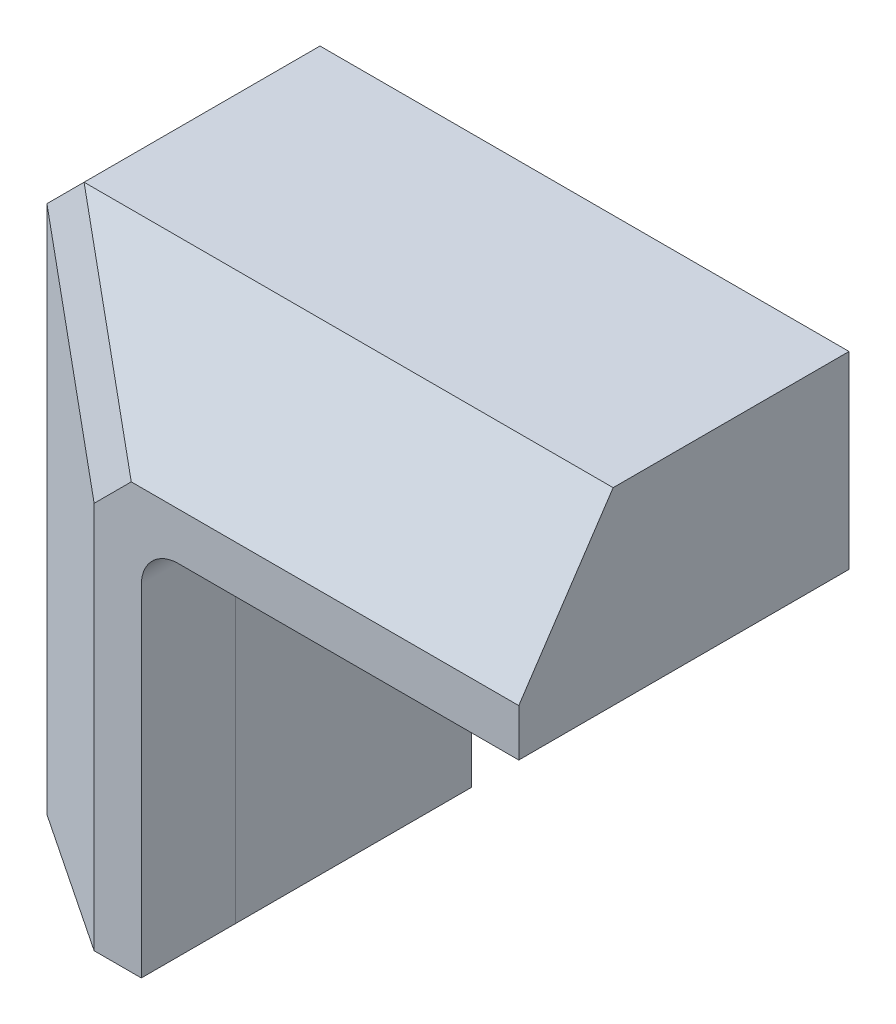
from build123d import *

# Parameters (mm, degrees)
BOSS_EXTRUDE1_DEPTH = 12.7
CUT_EXTRUDE1_DEPTH  = 2.54


with BuildPart() as part:
    # Sketch1 → Boss-Extrude1 (new body)
    with BuildSketch(Plane.XY):
        with BuildLine():
            Line((-10.16, 8.16102), (-8.16102, 10.16))
            Line((-8.16102, 10.16), (20.32, 10.16))
            Line((20.32, 10.16), (20.32, 0))
            Line((20.32, 0), (1.99898, 0))
            ThreePointArc((1.99898, 0), (0.585487687, -0.585487687), (0, -1.99898))
            Line((0, -1.99898), (0, -20.32))
            Line((0, -20.32), (-10.16, -20.32))
            Line((-10.16, -20.32), (-10.16, 0))
            Line((-10.16, 0), (-10.16, 8.16102))
        make_face()
    extrude(amount=BOSS_EXTRUDE1_DEPTH)

    # Sketch2 for Loft1 → Loft1 section 0
    with BuildSketch(Plane.XY.offset(12.7)):
        with BuildLine():
            Line((-10.16, -20.32), (0, -20.32))
            Line((0, -20.32), (0, -1.99898))
            # circular arc as an exact rational Bezier (weights 1, cos(half-angle), 1)
            Bezier((0, -1.99898), (0, 0), (1.99898, 0), weights=[1, 0.707106781, 1])
            Line((1.99898, 0), (20.32, 0))
            Line((20.32, 0), (20.32, 10.16))
            Line((20.32, 10.16), (-8.16102, 10.16))
            Line((-8.16102, 10.16), (-10.16, 8.16102))
            Line((-10.16, 8.16102), (-10.16, -20.32))
        make_face()
    # Sketch3 for Loft1 → Loft1 section 1
    with BuildSketch(Plane.XY.offset(17.78)):
        with BuildLine():
            Line((0, -20.32), (0, -1.99898))
            Bezier((0, -1.99898), (0, 0), (1.99898, 0), weights=[1, 0.707106781, 1])
            Line((1.99898, 0), (20.32, 0))
            Line((20.32, 0), (20.32, 2.54))
            Line((20.32, 2.54), (-0.54102, 2.54))
            Line((-0.54102, 2.54), (-2.54, 0.54102))
            Line((-2.54, 0.54102), (-2.54, -20.32))
            Line((-2.54, -20.32), (0, -20.32))
        make_face()
    loft()

    # Sketch4 → Cut-Extrude1 (cut)
    # profile 1 of 6: a face of its own
    with BuildSketch(Plane.XY):
        with BuildLine():
            Line((2.507435897, 5.290776242), (2.933567708, 4.900897436))
            add(Edge.make_bspline(
                [(2.933567708, 4.900897436), (2.951821368, 4.92664612), (2.986865849, 4.976080004), (3.043669297, 5.042273139), (3.100216248, 5.098740809), (3.157030576, 5.145247119), (3.214615861, 5.181509507), (3.272872143, 5.207183679), (3.331469152, 5.223504993), (3.370837296, 5.22553739), (3.390228365, 5.226538462)],
                knots=[0, 0, 0, 0, 1.299362458, 2.494594718, 3.587462134, 4.587049575, 5.512617175, 6.380583204, 7.202344345, 8, 8, 8, 8], degree=3))
            add(Edge.make_bspline(
                [(3.390228365, 5.226538462), (3.408315798, 5.225904137), (3.44323788, 5.224679422), (3.493021897, 5.212505847), (3.537220857, 5.191496044), (3.575791622, 5.16402396), (3.606345359, 5.130926467), (3.630740149, 5.096215707), (3.644476466, 5.057902879), (3.646284435, 5.031588082), (3.647179487, 5.018560697)],
                knots=[0, 0, 0, 0, 1.185010067, 2.2879431, 3.333075148, 4.379039566, 5.372662701, 6.27520591, 7.14612461, 8, 8, 8, 8], degree=3))
            add(Edge.make_bspline(
                [(3.647179487, 5.018560697), (3.646618603, 5.005345451), (3.645489061, 4.978731783), (3.634579223, 4.939726137), (3.61813498, 4.90161308), (3.602421836, 4.878411849), (3.594390024, 4.866552484)],
                knots=[0, 0, 0, 0, 0.967525499, 1.948461899, 2.951351359, 4, 4, 4, 4], degree=3))
            add(Edge.make_bspline(
                [(3.594390024, 4.866552484), (3.587088238, 4.857334324), (3.570280492, 4.836115336), (3.538231562, 4.802507766), (3.497984837, 4.761335552), (3.447991537, 4.714014485), (3.390327024, 4.658842714), (3.32231847, 4.597989063), (3.245923461, 4.529568965), (3.191623658, 4.481923686), (3.163170072, 4.456957131)],
                knots=[0, 0, 0, 0, 0.473873513, 1.090794244, 1.870441696, 2.795289791, 3.865433203, 5.087734844, 6.473946851, 8, 8, 8, 8], degree=3))
            add(Edge.make_bspline(
                [(3.163170072, 4.456957131), (3.136462289, 4.433842892), (3.085776466, 4.389976869), (3.013660605, 4.327716092), (2.950282774, 4.271701589), (2.894719702, 4.222774018), (2.847813672, 4.180420016), (2.80936749, 4.144437133), (2.778911602, 4.115525888), (2.761599213, 4.098063478), (2.754210737, 4.090610978)],
                knots=[0, 0, 0, 0, 1.543621617, 2.929473131, 4.163658386, 5.240097082, 6.164993805, 6.925417477, 7.541396219, 8, 8, 8, 8], degree=3))
            add(Edge.make_bspline(
                [(2.754210737, 4.090610978), (2.7261804, 4.060276149), (2.672296248, 4.001961956), (2.602265845, 3.911593297), (2.544628559, 3.823375058), (2.500039261, 3.735647272), (2.46636363, 3.6471442), (2.442621864, 3.55569531), (2.428402762, 3.460345018), (2.42682411, 3.395280084), (2.426025641, 3.362370793)],
                knots=[0, 0, 0, 0, 1.206664779, 2.319633467, 3.337109185, 4.282041471, 5.190008762, 6.099243693, 7.03861361, 8, 8, 8, 8], degree=3))
            add(Edge.make_bspline(
                [(2.426025641, 3.362370793), (2.426593971, 3.330304725), (2.427709055, 3.267389906), (2.441366696, 3.17532344), (2.460841691, 3.087211837), (2.49095345, 3.004013874), (2.527653483, 2.924363884), (2.573662275, 2.849502559), (2.627693293, 2.778672272), (2.689621135, 2.713139201), (2.758120683, 2.653672482), (2.831592957, 2.600733804), (2.910756408, 2.557026182), (2.994934675, 2.521036073), (3.084082699, 2.49331601), (3.178094278, 2.4728283), (3.27711321, 2.460531899), (3.344823782, 2.459246456), (3.379416066, 2.458589744)],
                knots=[0, 0, 0, 0, 1.043214005, 2.046824704, 3.02475056, 3.976699089, 4.921714032, 5.875962561, 6.831408892, 7.817874052, 8.806269674, 9.781291748, 10.760897367, 11.74438705, 12.757449933, 13.795994037, 14.874007457, 16, 16, 16, 16], degree=3))
            add(Edge.make_bspline(
                [(3.379416066, 2.458589744), (3.406570714, 2.459071485), (3.46035249, 2.46002561), (3.539618698, 2.467815242), (3.616159182, 2.480386881), (3.689887727, 2.498405794), (3.761136491, 2.521238201), (3.829908403, 2.549127112), (3.895728706, 2.582504794), (3.959095427, 2.620684869), (4.019700527, 2.665016965), (4.078310333, 2.714594728), (4.134342677, 2.770180684), (4.18806667, 2.831643377), (4.239138573, 2.899156853), (4.28923015, 2.971780861), (4.336115183, 3.050863206), (4.365078153, 3.106340111), (4.379871795, 3.134676482)],
                knots=[0, 0, 0, 0, 1.016823716, 2.013894106, 2.979844003, 3.91962641, 4.853723003, 5.779685073, 6.695824784, 7.614987388, 8.547259901, 9.504950863, 10.487499108, 11.500346958, 12.559593716, 13.656357062, 14.802919212, 16, 16, 16, 16], degree=3))
            Line((4.379871795, 3.134676482), (3.878689904, 3.435512821))
            add(Edge.make_bspline(
                [(3.878689904, 3.435512821), (3.860185268, 3.403347337), (3.824710301, 3.341683355), (3.764594652, 3.25882998), (3.703009239, 3.187879779), (3.638530262, 3.130086802), (3.571941761, 3.084678281), (3.502922098, 3.052226202), (3.431422782, 3.032138402), (3.382720696, 3.029685218), (3.358427484, 3.028461538)],
                knots=[0, 0, 0, 0, 1.283663364, 2.460892379, 3.537111102, 4.529833553, 5.449777664, 6.316464042, 7.160231139, 8, 8, 8, 8], degree=3))
            add(Edge.make_bspline(
                [(3.358427484, 3.028461538), (3.33371781, 3.029460861), (3.285777443, 3.031399693), (3.217348704, 3.049308096), (3.154610645, 3.077425604), (3.100380331, 3.117545409), (3.05446152, 3.163849762), (3.020570801, 3.215365473), (2.999280423, 3.271104227), (2.997029514, 3.309824033), (2.995897436, 3.329297877)],
                knots=[0, 0, 0, 0, 1.13588714, 2.203786484, 3.234766741, 4.283437687, 5.291419208, 6.222934724, 7.106237994, 8, 8, 8, 8], degree=3))
            add(Edge.make_bspline(
                [(2.995897436, 3.329297877), (2.996942864, 3.347415119), (2.999066551, 3.384218563), (3.014708974, 3.438939365), (3.039162852, 3.493635282), (3.068093514, 3.538498352), (3.097534086, 3.576060985), (3.125685913, 3.608607307), (3.15996739, 3.644565296), (3.200291597, 3.683980182), (3.246125744, 3.727198947), (3.29750844, 3.774217356), (3.355028073, 3.824621236), (3.395683063, 3.85895586), (3.416941106, 3.876909054)],
                knots=[0, 0, 0, 0, 0.916159276, 1.861089862, 2.860218735, 3.940849679, 4.552606315, 5.27541173, 6.11797699, 7.06649574, 8.129236253, 9.306560635, 10.591630461, 12, 12, 12, 12], degree=3))
            add(Edge.make_bspline(
                [(3.416941106, 3.876909054), (3.457353491, 3.911101808), (3.534917091, 3.976728051), (3.644524298, 4.073655946), (3.743290206, 4.164243946), (3.830361766, 4.249611915), (3.906848404, 4.328183306), (3.97223212, 4.400596305), (4.025794644, 4.46740948), (4.082157651, 4.546545214), (4.135713777, 4.642977544), (4.182001467, 4.758996816), (4.212030967, 4.875001367), (4.215395355, 4.952880433), (4.217051282, 4.991211939)],
                knots=[0, 0, 0, 0, 1.345494975, 2.582412109, 3.71882943, 4.751509156, 5.681369928, 6.505683931, 7.230279997, 7.856715994, 8.973648664, 10.023341002, 11.027102913, 12, 12, 12, 12], degree=3))
            add(Edge.make_bspline(
                [(4.217051282, 4.991211939), (4.216362584, 5.018394586), (4.215005775, 5.07194732), (4.202902832, 5.150688812), (4.184814522, 5.226667736), (4.158545103, 5.299606886), (4.124450569, 5.369414903), (4.083044082, 5.436433526), (4.033682677, 5.500045931), (3.978055706, 5.560209948), (3.916769027, 5.615193012), (3.851276421, 5.663721076), (3.781948583, 5.704708584), (3.709209626, 5.738710699), (3.632608817, 5.764737157), (3.552710469, 5.783186008), (3.469399985, 5.794158796), (3.412733991, 5.79565042), (3.383868189, 5.796410256)],
                knots=[0, 0, 0, 0, 1.010766082, 1.991317756, 2.957454644, 3.913069143, 4.869106762, 5.843196583, 6.838735724, 7.860187025, 8.887984031, 9.89767229, 10.887916223, 11.879572884, 12.879850636, 13.892031539, 14.926195476, 16, 16, 16, 16], degree=3))
            add(Edge.make_bspline(
                [(3.383868189, 5.796410256), (3.346459538, 5.795041768), (3.271937528, 5.792315594), (3.161754586, 5.770997805), (3.054132495, 5.737473336), (2.967408597, 5.697029753), (2.89840401, 5.657852034), (2.845518441, 5.621782126), (2.791704527, 5.580462108), (2.736528293, 5.533761769), (2.681014999, 5.480801214), (2.623586136, 5.42284121), (2.565024244, 5.359380848), (2.526968299, 5.314045059), (2.507435897, 5.290776242)],
                knots=[0, 0, 0, 0, 1.282922637, 2.555718331, 3.837320111, 5.142675274, 5.830281639, 6.55870424, 7.337177975, 8.157850921, 9.037902056, 9.96903443, 10.957596896, 12, 12, 12, 12], degree=3))
        make_face()
    # profile 2 of 6: a face of its own
    with BuildSketch(Plane.XY):
        Polygon((6.415128205, 5.715), (4.705512821, 5.715), (4.705512821, 5.145128205), (5.84525641, 5.145128205), (5.84525641, 4.534551282), (4.705512821, 4.534551282), (4.705512821, 3.964679487), (5.84525641, 3.964679487), (5.84525641, 3.109871795), (4.705512821, 3.109871795), (4.705512821, 2.54), (6.415128205, 2.54), align=None)
    # profile 3 of 6: a face of its own
    with BuildSketch(Plane.XY):
        Polygon((8.368974359, 5.715), (7.799102564, 5.715), (7.799102564, 3.109871795), (6.903589744, 3.109871795), (6.903589744, 2.54), (8.368974359, 2.54), align=None)
    # profile 4 of 6: a face of its own
    with BuildSketch(Plane.XY):
        Polygon((10.647825521, 5.715), (10.119294872, 5.715), (8.837083333, 2.54), (9.445752204, 2.54), (9.692527043, 3.191282051), (11.075865385, 3.191282051), (11.322640224, 2.54), (11.930673077, 2.54), align=None)
        Polygon((10.383878205, 4.863372396), (10.859619391, 3.761153846), (9.908137019, 3.761153846), align=None, mode=Mode.SUBTRACT)
    # profile 5 of 6: a face of its own
    with BuildSketch(Plane.XY):
        with BuildLine():
            Line((12.19525641, 5.164208734), (12.613119992, 4.764789663))
            add(Edge.make_bspline(
                [(12.613119992, 4.764789663), (12.648566585, 4.8014415), (12.717804887, 4.87303402), (12.829373847, 4.967816208), (12.945401503, 5.046804336), (13.06363077, 5.113327635), (13.186188247, 5.163657252), (13.311656838, 5.200333291), (13.440837696, 5.222693286), (13.528262332, 5.225251666), (13.572234575, 5.226538462)],
                knots=[0, 0, 0, 0, 1.115251505, 2.178435587, 3.19620269, 4.182487026, 5.141301733, 6.088180966, 7.038406374, 8, 8, 8, 8], degree=3))
            add(Edge.make_bspline(
                [(13.572234575, 5.226538462), (13.608956743, 5.225521848), (13.681423894, 5.223515672), (13.787824661, 5.208808428), (13.889602495, 5.183798119), (13.987105795, 5.149329281), (14.080047655, 5.104728433), (14.168622939, 5.050030097), (14.252613267, 4.985728275), (14.330909177, 4.912155668), (14.402531524, 4.831772066), (14.465814428, 4.746002955), (14.518824011, 4.655044826), (14.562328114, 4.559818837), (14.596216128, 4.459884235), (14.620416428, 4.3553083), (14.634413235, 4.245966489), (14.636502352, 4.171636741), (14.637564103, 4.133860176)],
                knots=[0, 0, 0, 0, 1.035432265, 2.043311493, 3.022114605, 3.98653278, 4.95457646, 5.923598177, 6.917315552, 7.932509744, 8.948865224, 9.949768934, 10.933144597, 11.912367597, 12.897413939, 13.903909035, 14.934704909, 16, 16, 16, 16], degree=3))
            add(Edge.make_bspline(
                [(14.637564103, 4.133860176), (14.637258118, 4.10734594), (14.636655016, 4.055085836), (14.630053002, 3.977778637), (14.619422202, 3.902772378), (14.6040368, 3.830180674), (14.584797204, 3.759940615), (14.562224777, 3.691446244), (14.533907999, 3.625643999), (14.502475949, 3.561769629), (14.465920836, 3.501566028), (14.426507681, 3.444156898), (14.38377055, 3.389823652), (14.337432631, 3.338788408), (14.286841776, 3.291848731), (14.23330557, 3.247593089), (14.175920934, 3.207129351), (14.11587989, 3.169442035), (14.052663761, 3.136702743), (13.987987745, 3.10704727), (13.920871226, 3.082962616), (13.852131385, 3.063548188), (13.782013876, 3.047039117), (13.709832885, 3.036873974), (13.636214129, 3.029176031), (13.586460207, 3.028700728), (13.561422276, 3.028461538)],
                knots=[0, 0, 0, 0, 1.103660481, 2.175337485, 3.227646561, 4.255952547, 5.262355991, 6.258840057, 7.255597736, 8.242457506, 9.22035537, 10.185017736, 11.140346927, 12.096287581, 13.051739095, 14.01125915, 14.986044842, 15.97314143, 16.960198552, 17.947847494, 18.933482797, 19.925264591, 20.920966487, 21.929612487, 22.958107872, 24, 24, 24, 24], degree=3))
            add(Edge.make_bspline(
                [(13.561422276, 3.028461538), (13.518953642, 3.029689957), (13.43551382, 3.032103479), (13.313053883, 3.050976883), (13.196361763, 3.082022564), (13.103125318, 3.11868571), (13.030077026, 3.154891042), (12.974466441, 3.188379191), (12.916960762, 3.225839363), (12.858515109, 3.268685345), (12.798472085, 3.316402968), (12.737891586, 3.370037337), (12.675222742, 3.427822348), (12.634169004, 3.469064647), (12.613119992, 3.490210337)],
                knots=[0, 0, 0, 0, 1.404581149, 2.759636711, 4.088442092, 5.392261763, 6.066678138, 6.783632037, 7.538459478, 8.336747902, 9.180226004, 10.074962426, 11.012997595, 12, 12, 12, 12], degree=3))
            Line((12.613119992, 3.490210337), (12.207976763, 3.064714543))
            add(Edge.make_bspline(
                [(12.207976763, 3.064714543), (12.236456151, 3.037218588), (12.292041827, 2.983552363), (12.375891275, 2.907351332), (12.459635195, 2.838876235), (12.541250509, 2.775641725), (12.622074161, 2.719489979), (12.702097578, 2.670364915), (12.780414862, 2.62702409), (12.858652296, 2.590198427), (12.937296712, 2.558929614), (13.018212575, 2.532009219), (13.101647252, 2.509235533), (13.188110323, 2.490860159), (13.276795313, 2.47612559), (13.368532197, 2.466179841), (13.462739317, 2.459493645), (13.526641466, 2.458892834), (13.558878205, 2.458589744)],
                knots=[0, 0, 0, 0, 1.244526981, 2.429050516, 3.560637417, 4.644440555, 5.67424972, 6.652764056, 7.595344123, 8.486817594, 9.369275933, 10.254498637, 11.166417451, 12.086725134, 13.032340136, 13.991389299, 14.986715468, 16, 16, 16, 16], degree=3))
            add(Edge.make_bspline(
                [(13.558878205, 2.458589744), (13.618093102, 2.460099249), (13.733960195, 2.463052933), (13.903760398, 2.484937726), (14.065066033, 2.521627196), (14.218269527, 2.573516227), (14.363322163, 2.639802032), (14.500186834, 2.721065316), (14.628642944, 2.817090176), (14.74765282, 2.926751107), (14.855302916, 3.047862399), (14.950453135, 3.177902701), (15.0291614, 3.317511114), (15.094514568, 3.464625175), (15.145619886, 3.619916222), (15.181589366, 3.783552234), (15.203771482, 3.95537521), (15.206198237, 4.072734263), (15.207435897, 4.132588141)],
                knots=[0, 0, 0, 0, 1.078019885, 2.10938526, 3.111377082, 4.085535484, 5.04941344, 6.010039228, 6.978205633, 7.964457913, 8.951525778, 9.924444315, 10.892603023, 11.863865945, 12.85144698, 13.863884204, 14.910567087, 16, 16, 16, 16], degree=3))
            add(Edge.make_bspline(
                [(15.207435897, 4.132588141), (15.206912922, 4.17162433), (15.205876512, 4.248984515), (15.194983752, 4.362942336), (15.179798611, 4.474030827), (15.155708765, 4.581096523), (15.126670831, 4.685581794), (15.090558346, 4.786351009), (15.047428985, 4.883693788), (14.99867291, 4.977773089), (14.94351565, 5.067972592), (14.881898936, 5.15351734), (14.815409021, 5.235067724), (14.742448262, 5.311541827), (14.664076874, 5.383611105), (14.579941019, 5.450885002), (14.490546733, 5.514328301), (14.395652058, 5.572304953), (14.297100545, 5.624747916), (14.196135188, 5.67100485), (14.093004046, 5.709664994), (13.988143169, 5.741732158), (13.88110952, 5.765668028), (13.772667077, 5.78378671), (13.661893127, 5.793915169), (13.587518016, 5.795573262), (13.549973958, 5.796410256)],
                knots=[0, 0, 0, 0, 1.071919942, 2.124283339, 3.142214191, 4.149696895, 5.136002878, 6.119640489, 7.086990633, 8.058538607, 9.028339693, 9.988281803, 10.952401235, 11.916291999, 12.888973767, 13.874849856, 14.873389453, 15.898127285, 16.927174885, 17.938320013, 18.946391617, 19.950418109, 20.947802303, 21.956882652, 22.968648068, 24, 24, 24, 24], degree=3))
            add(Edge.make_bspline(
                [(13.549973958, 5.796410256), (13.517945028, 5.79593047), (13.454220179, 5.794975887), (13.359323186, 5.787018393), (13.265185134, 5.774521229), (13.172143067, 5.755665671), (13.079531453, 5.73328174), (12.988567312, 5.70397307), (12.897815636, 5.671303034), (12.80869973, 5.632252678), (12.721095201, 5.589625686), (12.637054324, 5.541263816), (12.555166059, 5.490143202), (12.477245002, 5.433238304), (12.401831523, 5.372613168), (12.329319966, 5.307984943), (12.260346663, 5.238276087), (12.217062847, 5.189022665), (12.19525641, 5.164208734)],
                knots=[0, 0, 0, 0, 0.996412454, 1.982464992, 2.961075852, 3.949442424, 4.934965278, 5.923860011, 6.921385422, 7.934793307, 8.949617135, 9.951082467, 10.950285876, 11.951772932, 12.951063433, 13.960125323, 14.972308753, 16, 16, 16, 16], degree=3))
        make_face()
    # profile 6 of 6: a face of its own
    with BuildSketch(Plane.XY):
        with BuildLine():
            Line((15.695897436, 5.290776242), (16.122029247, 4.900897436))
            add(Edge.make_bspline(
                [(16.122029247, 4.900897436), (16.140282906, 4.92664612), (16.175327387, 4.976080004), (16.232130835, 5.042273139), (16.288677787, 5.098740809), (16.345492115, 5.145247119), (16.4030774, 5.181509507), (16.461333682, 5.207183679), (16.51993069, 5.223504993), (16.559298835, 5.22553739), (16.578689904, 5.226538462)],
                knots=[0, 0, 0, 0, 1.299362458, 2.494594718, 3.587462134, 4.587049575, 5.512617175, 6.380583204, 7.202344345, 8, 8, 8, 8], degree=3))
            add(Edge.make_bspline(
                [(16.578689904, 5.226538462), (16.596777337, 5.225904137), (16.631699418, 5.224679422), (16.681483435, 5.212505847), (16.725682395, 5.191496044), (16.764253161, 5.16402396), (16.794806898, 5.130926467), (16.819201688, 5.096215707), (16.832938004, 5.057902879), (16.834745973, 5.031588082), (16.835641026, 5.018560697)],
                knots=[0, 0, 0, 0, 1.185010067, 2.2879431, 3.333075148, 4.379039566, 5.372662701, 6.27520591, 7.14612461, 8, 8, 8, 8], degree=3))
            add(Edge.make_bspline(
                [(16.835641026, 5.018560697), (16.835080142, 5.005345451), (16.8339506, 4.978731783), (16.823040761, 4.939726137), (16.806596519, 4.90161308), (16.790883374, 4.878411849), (16.782851563, 4.866552484)],
                knots=[0, 0, 0, 0, 0.967525499, 1.948461899, 2.951351359, 4, 4, 4, 4], degree=3))
            add(Edge.make_bspline(
                [(16.782851563, 4.866552484), (16.775549777, 4.857334324), (16.75874203, 4.836115336), (16.7266931, 4.802507766), (16.686446375, 4.761335552), (16.636453076, 4.714014485), (16.578788562, 4.658842714), (16.510780009, 4.597989063), (16.434384999, 4.529568965), (16.380085196, 4.481923686), (16.351631611, 4.456957131)],
                knots=[0, 0, 0, 0, 0.473873513, 1.090794244, 1.870441696, 2.795289791, 3.865433203, 5.087734844, 6.473946851, 8, 8, 8, 8], degree=3))
            add(Edge.make_bspline(
                [(16.351631611, 4.456957131), (16.324923828, 4.433842892), (16.274238004, 4.389976869), (16.202122143, 4.327716092), (16.138744312, 4.271701589), (16.08318124, 4.222774018), (16.03627521, 4.180420016), (15.997829029, 4.144437133), (15.967373141, 4.115525888), (15.950060752, 4.098063478), (15.942672276, 4.090610978)],
                knots=[0, 0, 0, 0, 1.543621617, 2.929473131, 4.163658386, 5.240097082, 6.164993805, 6.925417477, 7.541396219, 8, 8, 8, 8], degree=3))
            add(Edge.make_bspline(
                [(15.942672276, 4.090610978), (15.914641938, 4.060276149), (15.860757786, 4.001961956), (15.790727384, 3.911593297), (15.733090097, 3.823375058), (15.688500799, 3.735647272), (15.654825168, 3.6471442), (15.631083402, 3.55569531), (15.616864301, 3.460345018), (15.615285648, 3.395280084), (15.614487179, 3.362370793)],
                knots=[0, 0, 0, 0, 1.206664779, 2.319633467, 3.337109185, 4.282041471, 5.190008762, 6.099243693, 7.03861361, 8, 8, 8, 8], degree=3))
            add(Edge.make_bspline(
                [(15.614487179, 3.362370793), (15.615055509, 3.330304725), (15.616170593, 3.267389906), (15.629828235, 3.17532344), (15.64930323, 3.087211837), (15.679414988, 3.004013874), (15.716115022, 2.924363884), (15.762123814, 2.849502559), (15.816154832, 2.778672272), (15.878082674, 2.713139201), (15.946582221, 2.653672482), (16.020054496, 2.600733804), (16.099217946, 2.557026182), (16.183396213, 2.521036073), (16.272544237, 2.49331601), (16.366555817, 2.4728283), (16.465574748, 2.460531899), (16.53328532, 2.459246456), (16.567877604, 2.458589744)],
                knots=[0, 0, 0, 0, 1.043214005, 2.046824704, 3.02475056, 3.976699089, 4.921714032, 5.875962561, 6.831408892, 7.817874052, 8.806269674, 9.781291748, 10.760897367, 11.74438705, 12.757449933, 13.795994037, 14.874007457, 16, 16, 16, 16], degree=3))
            add(Edge.make_bspline(
                [(16.567877604, 2.458589744), (16.595032252, 2.459071485), (16.648814029, 2.46002561), (16.728080236, 2.467815242), (16.804620721, 2.480386881), (16.878349265, 2.498405794), (16.94959803, 2.521238201), (17.018369941, 2.549127112), (17.084190244, 2.582504794), (17.147556966, 2.620684869), (17.208162066, 2.665016965), (17.266771872, 2.714594728), (17.322804215, 2.770180684), (17.376528209, 2.831643377), (17.427600111, 2.899156853), (17.477691689, 2.971780861), (17.524576721, 3.050863206), (17.553539691, 3.106340111), (17.568333333, 3.134676482)],
                knots=[0, 0, 0, 0, 1.016823716, 2.013894106, 2.979844003, 3.91962641, 4.853723003, 5.779685073, 6.695824784, 7.614987388, 8.547259901, 9.504950863, 10.487499108, 11.500346958, 12.559593716, 13.656357062, 14.802919212, 16, 16, 16, 16], degree=3))
            Line((17.568333333, 3.134676482), (17.067151442, 3.435512821))
            add(Edge.make_bspline(
                [(17.067151442, 3.435512821), (17.048646807, 3.403347337), (17.013171839, 3.341683355), (16.953056191, 3.25882998), (16.891470777, 3.187879779), (16.8269918, 3.130086802), (16.760403299, 3.084678281), (16.691383636, 3.052226202), (16.61988432, 3.032138402), (16.571182234, 3.029685218), (16.546889022, 3.028461538)],
                knots=[0, 0, 0, 0, 1.283663364, 2.460892379, 3.537111102, 4.529833553, 5.449777664, 6.316464042, 7.160231139, 8, 8, 8, 8], degree=3))
            add(Edge.make_bspline(
                [(16.546889022, 3.028461538), (16.522179348, 3.029460861), (16.474238981, 3.031399693), (16.405810243, 3.049308096), (16.343072184, 3.077425604), (16.288841869, 3.117545409), (16.242923058, 3.163849762), (16.20903234, 3.215365473), (16.187741962, 3.271104227), (16.185491053, 3.309824033), (16.184358974, 3.329297877)],
                knots=[0, 0, 0, 0, 1.13588714, 2.203786484, 3.234766741, 4.283437687, 5.291419208, 6.222934724, 7.106237994, 8, 8, 8, 8], degree=3))
            add(Edge.make_bspline(
                [(16.184358974, 3.329297877), (16.185404402, 3.347415119), (16.187528089, 3.384218563), (16.203170512, 3.438939365), (16.22762439, 3.493635282), (16.256555053, 3.538498352), (16.285995624, 3.576060985), (16.314147451, 3.608607307), (16.348428929, 3.644565296), (16.388753135, 3.683980182), (16.434587282, 3.727198947), (16.485969979, 3.774217356), (16.543489612, 3.824621236), (16.584144601, 3.85895586), (16.605402644, 3.876909054)],
                knots=[0, 0, 0, 0, 0.916159276, 1.861089862, 2.860218735, 3.940849679, 4.552606315, 5.27541173, 6.11797699, 7.06649574, 8.129236253, 9.306560635, 10.591630461, 12, 12, 12, 12], degree=3))
            add(Edge.make_bspline(
                [(16.605402644, 3.876909054), (16.64581503, 3.911101808), (16.723378629, 3.976728051), (16.832985837, 4.073655946), (16.931751744, 4.164243946), (17.018823304, 4.249611915), (17.095309942, 4.328183306), (17.160693658, 4.400596305), (17.214256182, 4.46740948), (17.270619189, 4.546545214), (17.324175315, 4.642977544), (17.370463006, 4.758996816), (17.400492506, 4.875001367), (17.403856893, 4.952880433), (17.405512821, 4.991211939)],
                knots=[0, 0, 0, 0, 1.345494975, 2.582412109, 3.71882943, 4.751509156, 5.681369928, 6.505683931, 7.230279997, 7.856715994, 8.973648664, 10.023341002, 11.027102913, 12, 12, 12, 12], degree=3))
            add(Edge.make_bspline(
                [(17.405512821, 4.991211939), (17.404824123, 5.018394586), (17.403467314, 5.07194732), (17.391364371, 5.150688812), (17.373276061, 5.226667736), (17.347006642, 5.299606886), (17.312912108, 5.369414903), (17.27150562, 5.436433526), (17.222144216, 5.500045931), (17.166517245, 5.560209948), (17.105230565, 5.615193012), (17.03973796, 5.663721076), (16.970410122, 5.704708584), (16.897671165, 5.738710699), (16.821070355, 5.764737157), (16.741172008, 5.783186008), (16.657861523, 5.794158796), (16.60119553, 5.79565042), (16.572329728, 5.796410256)],
                knots=[0, 0, 0, 0, 1.010766082, 1.991317756, 2.957454644, 3.913069143, 4.869106762, 5.843196583, 6.838735724, 7.860187025, 8.887984031, 9.89767229, 10.887916223, 11.879572884, 12.879850636, 13.892031539, 14.926195476, 16, 16, 16, 16], degree=3))
            add(Edge.make_bspline(
                [(16.572329728, 5.796410256), (16.534921077, 5.795041768), (16.460399066, 5.792315594), (16.350216124, 5.770997805), (16.242594034, 5.737473336), (16.155870136, 5.697029753), (16.086865549, 5.657852034), (16.033979979, 5.621782126), (15.980166065, 5.580462108), (15.924989831, 5.533761769), (15.869476537, 5.480801214), (15.812047675, 5.42284121), (15.753485782, 5.359380848), (15.715429837, 5.314045059), (15.695897436, 5.290776242)],
                knots=[0, 0, 0, 0, 1.282922637, 2.555718331, 3.837320111, 5.142675274, 5.830281639, 6.55870424, 7.337177975, 8.157850921, 9.037902056, 9.96903443, 10.957596896, 12, 12, 12, 12], degree=3))
        make_face()
    extrude(amount=CUT_EXTRUDE1_DEPTH, mode=Mode.SUBTRACT)


solid = part.part
